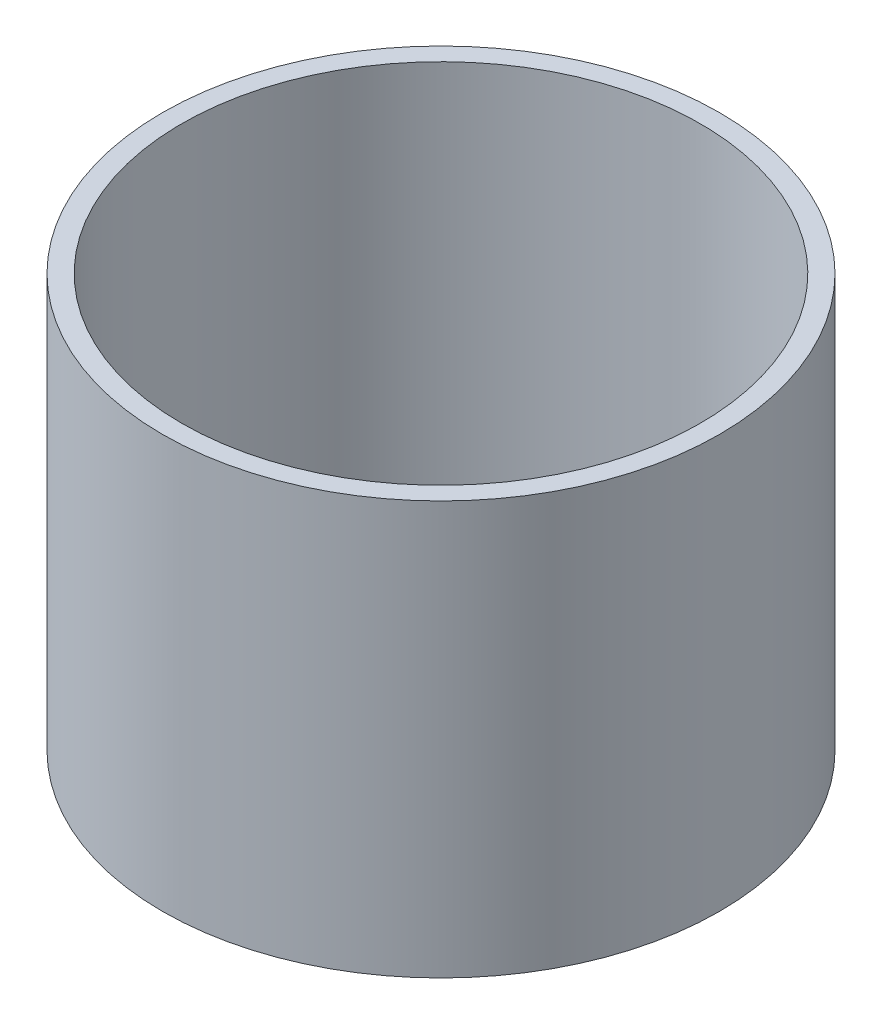
from build123d import *

# Parameters (mm, degrees)
SKETCH1_R           = 73.66
SKETCH1_R_2         = 68.58
BOSS_EXTRUDE1_DEPTH = 104.14
BOSS_EXTRUDE2_START = 5.08
SKETCH2_R           = 73.66
SKETCH2_R_2         = 3.3782
BOSS_EXTRUDE2_DEPTH = 5.08


with BuildPart() as part:
    # Sketch1 → Boss-Extrude1 (new body)
    with BuildSketch(Plane(origin=(0, 0, 0), x_dir=(1, 0, 0), z_dir=(0, 1, 0))):
        with Locations(Location((0, 0, 0), (0, 0, 270))):
            Circle(SKETCH1_R)
        with Locations(Location((0, 0, 0), (0, 0, 270))):
            Circle(SKETCH1_R_2, mode=Mode.SUBTRACT)
    extrude(amount=BOSS_EXTRUDE1_DEPTH)

    # Sketch2 → Boss-Extrude2 (add)
    with BuildSketch(Plane.XZ.offset(BOSS_EXTRUDE2_START)):
        with Locations(Location((0, 0, 0), (0, 0, 270))):
            Circle(SKETCH2_R)
        with Locations(Location((0, 48.26, 0), (0, 0, 270))):
            Circle(SKETCH2_R_2, mode=Mode.SUBTRACT)
        with Locations(Location((48.26, 0, 0), (0, 0, 270))):
            Circle(SKETCH2_R_2, mode=Mode.SUBTRACT)
        with Locations(Location((0, -48.26, 0), (0, 0, 270))):
            Circle(SKETCH2_R_2, mode=Mode.SUBTRACT)
        with Locations(Location((-48.26, 0, 0), (0, 0, 270))):
            Circle(SKETCH2_R_2, mode=Mode.SUBTRACT)
    extrude(amount=-BOSS_EXTRUDE2_DEPTH)


solid = part.part
